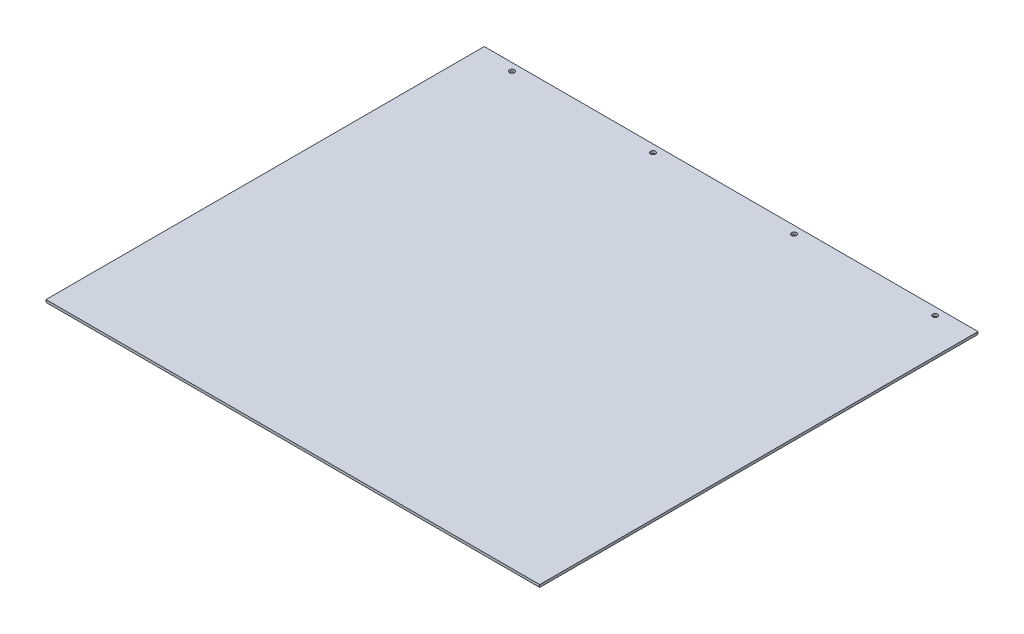
from build123d import *

# Parameters (mm, degrees)
SKETCH1_W           = 622.3
SKETCH1_H           = 552.45
SKETCH1_R           = 3.175
BOSS_EXTRUDE1_DEPTH = 3.175


with BuildPart() as part:
    # Sketch1 → Boss-Extrude1 (new body)
    with BuildSketch(Plane(origin=(0, 0, 0), x_dir=(1, 0, 0), z_dir=(0, 1, 0))):
        with Locations((311.15, 276.225)):
            Rectangle(SKETCH1_W, SKETCH1_H)
        with Locations(Location((44.45, 542.925, 0), (0, 0, 270))):
            Circle(SKETCH1_R, mode=Mode.SUBTRACT)
        with Locations(Location((222.25, 542.925, 0), (0, 0, 270))):
            Circle(SKETCH1_R, mode=Mode.SUBTRACT)
        with Locations(Location((577.85, 542.925, 0), (0, 0, 270))):
            Circle(SKETCH1_R, mode=Mode.SUBTRACT)
        with Locations(Location((400.05, 542.925, 0), (0, 0, 270))):
            Circle(SKETCH1_R, mode=Mode.SUBTRACT)
    extrude(amount=BOSS_EXTRUDE1_DEPTH)


solid = part.part
